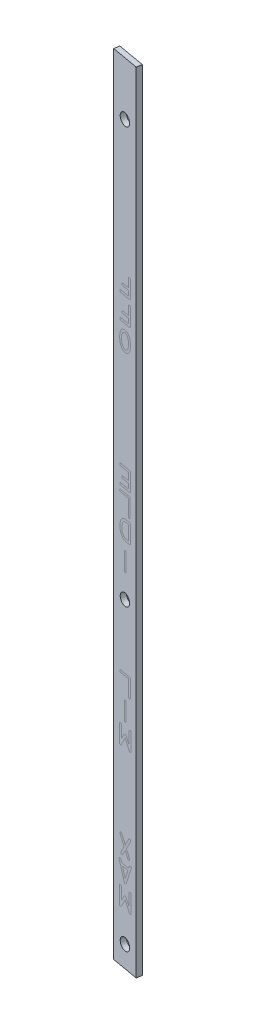
from build123d import *

# Parameters (mm, degrees)
SKETCH1_W             = 8.255
SKETCH1_H             = 237.248411897
BOSS_EXTRUDE1_DEPTH   = 1.5875
CUT_EXTRUDE1_DEPTH    = 2.336885598
F_4_CLEARANCE_HOLE1_D = 3.4544


with BuildPart() as part:
    # Sketch1 → Boss-Extrude1 (new body)
    with BuildSketch(Plane(origin=(23.448725568, 0, -121.072657859), x_dir=(0.9848077530122085, 0, 0.17364817766692836), z_dir=(-0.17364817766692836, 0, 0.9848077530122085))):
        with Locations((-157.300223262, 29.663605247)):
            Rectangle(SKETCH1_W, SKETCH1_H)
    extrude(amount=BOSS_EXTRUDE1_DEPTH)

    # Sketch6 → Cut-Extrude1 (cut)
    with BuildSketch(Plane.XZ.offset(88.960600702)):
        Polygon((-135.526547851, -149.104287829), (-127.39695985, -147.670822122), (-127.672626332, -146.107439814), (-135.802214333, -147.540905521), align=None)
    extrude(amount=-CUT_EXTRUDE1_DEPTH, mode=Mode.SUBTRACT)

    # #4 Clearance Hole1 (through all)
    with Locations(Plane(origin=(21.136043007, 0, -119.868456446), x_dir=(0.9848077530122086, 0, 0.17364817766692783), z_dir=(-0.1736481776669278, 0, 0.9848077530122085))):
        with Locations((-155.231782926, -80.273715104), (-155.231782926, 132.412811195), (-155.231782926, 8.587811195)):
            Hole(F_4_CLEARANCE_HOLE1_D / 2)


solid = part.part
